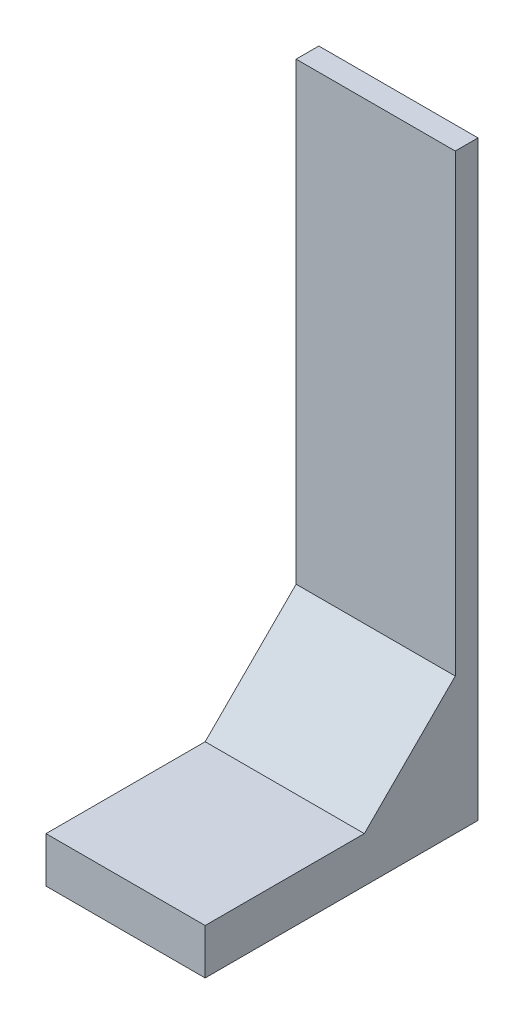
from build123d import *

# Parameters (mm, degrees)
BOSS_EXTRUDE1_DEPTH = 22.225
CHAMFER1_SIZE       = 25.4


with BuildPart() as part:
    # Sketch1 → Boss-Extrude1 (new, symmetric)
    with BuildSketch(Plane(origin=(0, 0, 0), x_dir=(0, 0, -1), z_dir=(1, 0, 0))):
        Polygon((0, 0), (0, 165.1), (-6.35, 165.1), (-6.35, 12.7), (-76.2, 12.7), (-76.2, 0), align=None)
    extrude(amount=BOSS_EXTRUDE1_DEPTH, both=True)

    # Chamfer1
    chamfer1_edges = [part.edges().sort_by_distance(p)[0] for p in [
        (0, 12.7, 6.35),
    ]]
    chamfer(chamfer1_edges, length=CHAMFER1_SIZE)


solid = part.part
